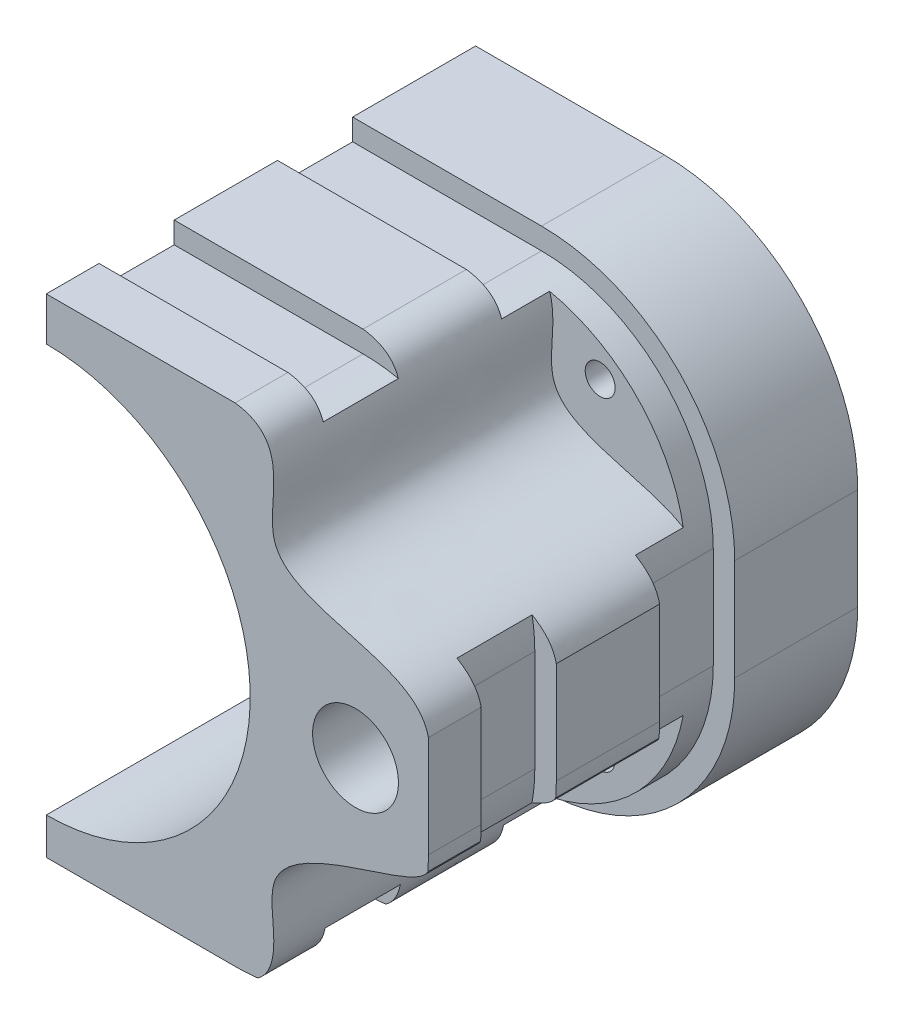
from build123d import *

# Parameters (mm, degrees)
ESBO_O1_R                = 1.393053459
ESBO_O1_R_2              = 4
ESBO_O1_R_3              = 1.370583382
RESSALTO_EXTRUS_O1_DEPTH = 40
CORTE_EXTRUS_O1_START    = -26
ESBO_O5_R                = 1.393053459
ESBO_O5_R_2              = 1.370583382
CORTE_EXTRUS_O1_DEPTH    = 26
ESBO_O8_W                = 7
ESBO_O8_H                = 2


with BuildPart() as part:
    # Esboço1 → Ressalto-extrusão1 (new body)
    with BuildSketch(Plane.XY):
        with BuildLine():
            Line((-90, -22.423877672), (-90, -19))
            ThreePointArc((-90, -19), (-71, 0), (-90, 19))
            Line((-90, 19), (-90, 23.042521341))
            Line((-90, 23.042521341), (-72.401791427, 23.042521341))
            ThreePointArc((-72.401791427, 23.042521341), (-59.673869366, 17.770443402), (-54.401791427, 5.042521341))
            Line((-54.401791427, 5.042521341), (-54.401791427, -4.423877672))
            ThreePointArc((-54.401791427, -4.423877672), (-59.673869366, -17.151799733), (-72.401791427, -22.423877672))
            Line((-72.401791427, -22.423877672), (-90, -22.423877672))
        make_face()
        with Locations((-64.399704634, 15.948259466)):
            Circle(ESBO_O1_R, mode=Mode.SUBTRACT)
        with Locations((-61.189365531, 0)):
            Circle(ESBO_O1_R_2, mode=Mode.SUBTRACT)
        with Locations((-64.399704634, -14.228928105)):
            Circle(ESBO_O1_R_3, mode=Mode.SUBTRACT)
    extrude(amount=RESSALTO_EXTRUS_O1_DEPTH)

    # Esboço5 → Corte-extrusão1 (cut)
    # profile 1 of 3: a face of its own
    with BuildSketch(Plane.XY.offset(40).offset(CORTE_EXTRUS_O1_START)):
        with BuildLine():
            add(Edge.make_bspline(
                [(-54.401791427, 5.042521341), (-55.530001159, 10.383788665), (-70.453859237, 8.636772089), (-68.317241022, 19.151967947), (-69.419494496, 22.655429754), (-72.401791427, 23.042521341)],
                knots=[0, 0, 0, 0, 0.59841234, 0.778329044, 1, 1, 1, 1], degree=3))
            ThreePointArc((-72.401791427, 23.042521341), (-59.673869366, 17.770443402), (-54.401791427, 5.042521341))
        make_face()
        with Locations((-64.399704634, 15.948259466)):
            Circle(ESBO_O5_R, mode=Mode.SUBTRACT)
    # profile 2 of 3: a face of its own
    with BuildSketch(Plane.XY.offset(40).offset(CORTE_EXTRUS_O1_START)):
        with BuildLine():
            add(Edge.make_bspline(
                [(-54.455116699, -5.808387052), (-55.021642733, -6.906023952), (-60.824639792, -8.65742119), (-69.99744996, -12.030398314), (-68.624992944, -17.552582132), (-68.947451642, -20.712215011), (-69.65151808, -21.847158712), (-70.29295532, -22.299917789)],
                knots=[0.054307943, 0.054307943, 0.054307943, 0.054307943, 0.303140082, 0.59841234, 0.778329044, 0.849345989, 0.932732603, 0.932732603, 0.932732603, 0.932732603], degree=3))
            ThreePointArc((-70.29295532, -22.299917789), (-59.419167454, -16.891895749), (-54.455116699, -5.808387052))
        make_face()
        with Locations((-64.399704634, -14.228928105)):
            Circle(ESBO_O5_R_2, mode=Mode.SUBTRACT)
    # profile 3 of 3: a face of its own
    with BuildSketch(Plane.XY.offset(40).offset(CORTE_EXTRUS_O1_START)):
        with Locations((-64.399704634, 15.948259466)):
            Circle(ESBO_O5_R)
    extrude(amount=CORTE_EXTRUS_O1_DEPTH, mode=Mode.SUBTRACT)

    # Varredura de corte1: sweep along a path in Esboço7
    with BuildLine(Plane.XY.offset(40)) as varredura_de_corte1_path:
        Line((-90, 23.042521341), (-72.401791427, 23.042521341))
        ThreePointArc((-72.401791427, 23.042521341), (-59.673869366, 17.770443402), (-54.401791427, 5.042521341))
        Line((-54.401791427, 5.042521341), (-54.401791427, -4.423877672))
        ThreePointArc((-54.401791427, -4.423877672), (-54.415127686, -5.116645636), (-54.455116699, -5.808387052))
        ThreePointArc((-54.455116699, -5.808387052), (-59.419167454, -16.891895749), (-70.29295532, -22.299917789))
        ThreePointArc((-70.29295532, -22.299917789), (-71.345553317, -22.392860978), (-72.401791427, -22.423877672))
        Line((-72.401791427, -22.423877672), (-90, -22.423877672))
    # Esboço8 → Varredura de corte1 (sweep, cut)
    with BuildSketch(Plane.ZY.offset(90)):
        with Locations((31.583750193, 22.042521341)):
            Rectangle(ESBO_O8_W, ESBO_O8_H)
        with Locations((14.959531016, 22.042521341)):
            Rectangle(ESBO_O8_W, ESBO_O8_H)
    sweep(path=varredura_de_corte1_path.line, mode=Mode.SUBTRACT)


solid = part.part
